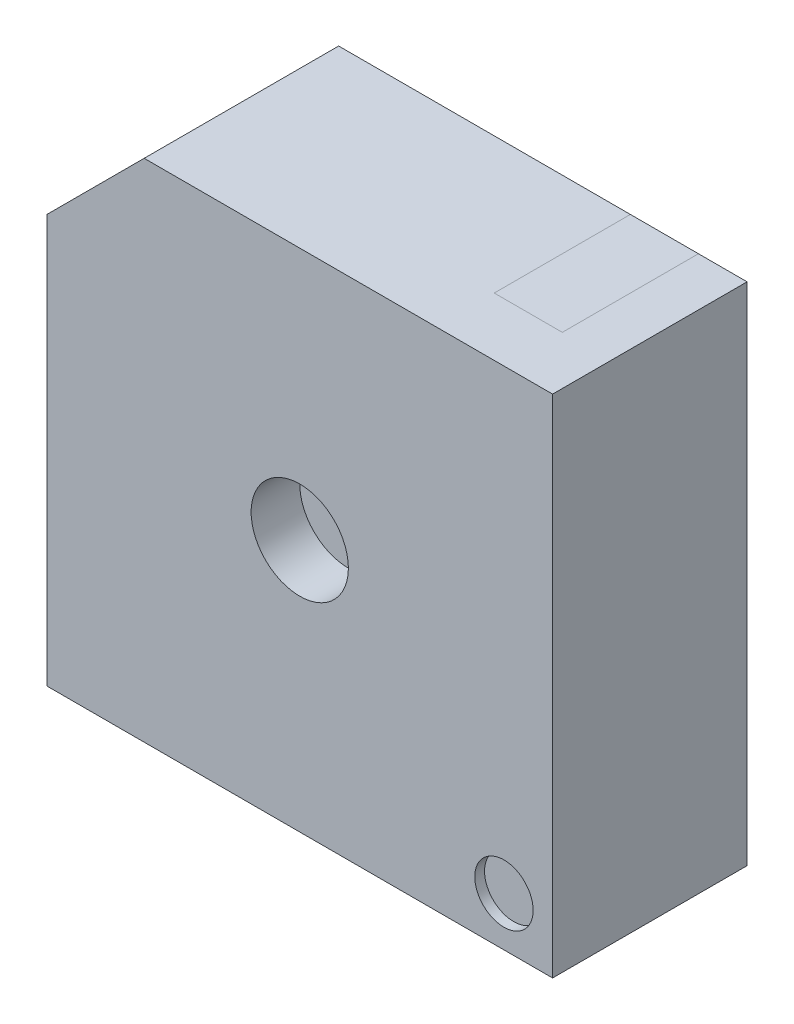
from build123d import *

# Parameters (mm, degrees)
EXTRUDE_1_DEPTH     = 2
SKETCH_2_R          = 0.5
CUT_EXTRUDE_1_DEPTH = 0.5
SKETCH_2_3_R        = 0.3
CUT_EXTRUDE_2_DEPTH = 0.1


with BuildPart() as part:
    # 草图1 → 凸台-拉伸1 (new body)
    with BuildSketch(Plane.XY):
        Polygon((-1.6, 2.6), (2.6, 2.6), (2.6, -2.6), (-2.6, -2.6), (-2.6, 1.6), align=None)
    extrude(amount=EXTRUDE_1_DEPTH)

    # 草图2 → 切除-拉伸1 (cut)
    with BuildSketch(Plane.XY.offset(2)):
        Circle(SKETCH_2_R)
    extrude(amount=-CUT_EXTRUDE_1_DEPTH, mode=Mode.SUBTRACT)

    # 草图2<3> → 切除-拉伸2 (cut)
    with BuildSketch(Plane.XY.offset(2)):
        with Locations((2.1, -2.098009883)):
            Circle(SKETCH_2_3_R)
    extrude(amount=-CUT_EXTRUDE_2_DEPTH, mode=Mode.SUBTRACT)


solid = part.part
